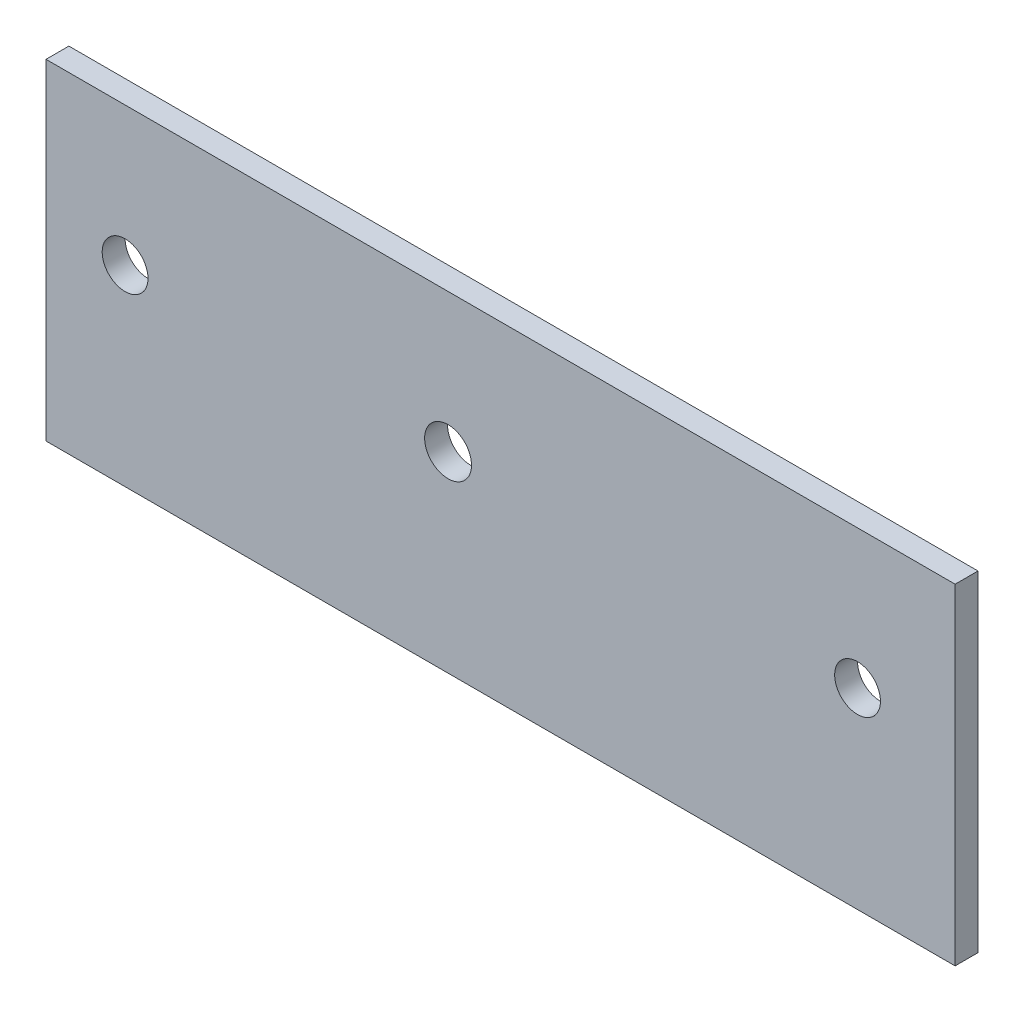
from build123d import *

# Parameters (mm, degrees)
SKETCH1_W           = 126.10501447
SKETCH1_H           = 45.85615954
SKETCH1_R           = 3.2512
SKETCH1_R_2         = 3.175
BOSS_EXTRUDE1_DEPTH = 3.175


with BuildPart() as part:
    # Sketch1 → Boss-Extrude1 (new body)
    with BuildSketch(Plane.XY):
        with Locations((26.681750969, -3.681459025)):
            Rectangle(SKETCH1_W, SKETCH1_H)
        with Locations((19.399321143, 0)):
            Circle(SKETCH1_R, mode=Mode.SUBTRACT)
        with Locations((76.2, 0)):
            Circle(SKETCH1_R_2, mode=Mode.SUBTRACT)
        with Locations((-25.4, 0)):
            Circle(SKETCH1_R_2, mode=Mode.SUBTRACT)
    extrude(amount=BOSS_EXTRUDE1_DEPTH)


solid = part.part
